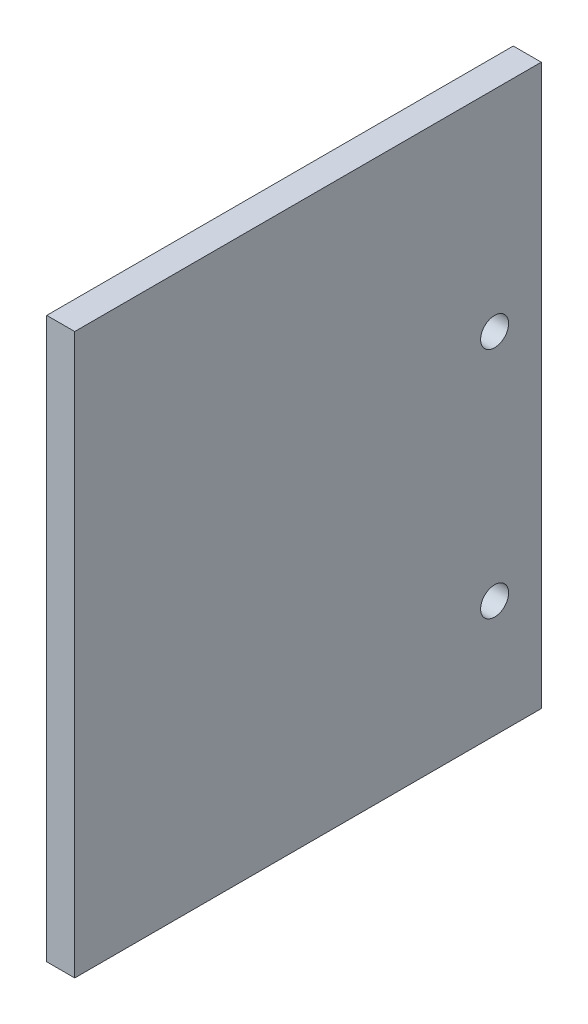
from build123d import *

# Parameters (mm, degrees)
SKIZZE1_W                       = 50
SKIZZE1_H                       = 60
AUFSATZ_LINEAR_AUSTRAGEN1_DEPTH = 3
SKIZZE2_R                       = 1.5
SCHNITT_LINEAR_AUSTRAGEN1_DEPTH = 40.166312055


with BuildPart() as part:
    # Skizze1 → Aufsatz-Linear austragen1 (new body)
    with BuildSketch(Plane(origin=(0, 0, 0), x_dir=(0, 0, -1), z_dir=(1, 0, 0))):
        Rectangle(SKIZZE1_W, SKIZZE1_H)
    extrude(amount=AUFSATZ_LINEAR_AUSTRAGEN1_DEPTH)

    # Skizze2 → Schnitt-Linear austragen1 (cut, through all)
    with BuildSketch(Plane(origin=(3, 0, 0), x_dir=(0, 0, -1), z_dir=(1, 0, 0))):
        with Locations((20, 7.5)):
            Circle(SKIZZE2_R)
        with Locations((20, -17.5)):
            Circle(SKIZZE2_R)
    extrude(amount=-SCHNITT_LINEAR_AUSTRAGEN1_DEPTH, mode=Mode.SUBTRACT)


solid = part.part
